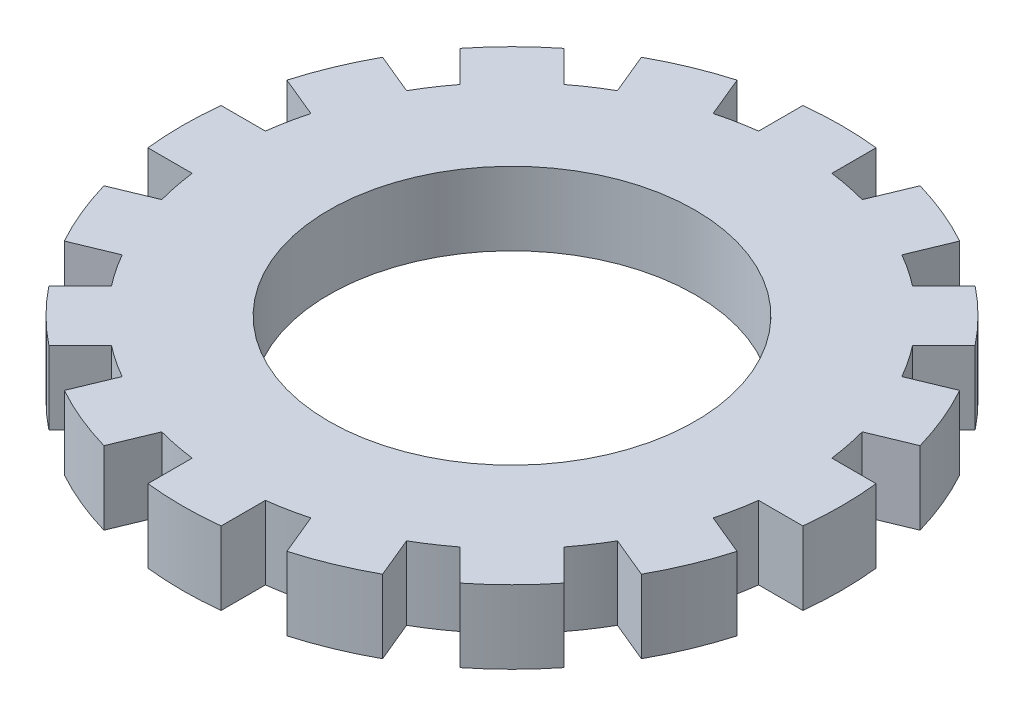
from build123d import *

# Parameters (mm, degrees)
SKETCH1_R           = 25
BOSS_EXTRUDE1_DEPTH = 5


with BuildPart() as part:
    # Sketch1 → Boss-Extrude1 (new, symmetric)
    with BuildSketch(Plane(origin=(0, 0, 0), x_dir=(1, 0, 0), z_dir=(0, 1, 0))):
        with BuildLine():
            Line((10.182093062, 37.647376813), (12.49472571, 43.230565916))
            ThreePointArc((12.49472571, 43.230565916), (17.220754456, 41.574578963), (21.733521035, 39.403731592))
            Line((21.733521035, 39.403731592), (19.420888387, 33.820542489))
            ThreePointArc((19.420888387, 33.820542489), (21.667239088, 32.42731488), (23.814054756, 30.885122568))
            Line((23.814054756, 30.885122568), (28.087242696, 35.158310508))
            ThreePointArc((28.087242696, 35.158310508), (31.819805153, 31.819805153), (35.158310508, 28.087242696))
            Line((35.158310508, 28.087242696), (30.885122568, 23.814054756))
            ThreePointArc((30.885122568, 23.814054756), (32.42731488, 21.667239088), (33.820542489, 19.420888387))
            Line((33.820542489, 19.420888387), (39.403731592, 21.733521035))
            ThreePointArc((39.403731592, 21.733521035), (41.574578963, 17.220754456), (43.230565916, 12.49472571))
            Line((43.230565916, 12.49472571), (37.647376813, 10.182093062))
            ThreePointArc((37.647376813, 10.182093062), (38.250625936, 7.608522559), (38.678159212, 5))
            Line((38.678159212, 5), (44.72135955, 5))
            ThreePointArc((44.72135955, 5), (45, 0), (44.72135955, -5))
            Line((44.72135955, -5), (38.678159212, -5))
            ThreePointArc((38.678159212, -5), (38.250625936, -7.608522559), (37.647376813, -10.182093062))
            Line((37.647376813, -10.182093062), (43.230565916, -12.49472571))
            ThreePointArc((43.230565916, -12.49472571), (41.574578963, -17.220754456), (39.403731592, -21.733521035))
            Line((39.403731592, -21.733521035), (33.820542489, -19.420888387))
            ThreePointArc((33.820542489, -19.420888387), (32.42731488, -21.667239088), (30.885122568, -23.814054756))
            Line((30.885122568, -23.814054756), (35.158310508, -28.087242696))
            ThreePointArc((35.158310508, -28.087242696), (31.819805153, -31.819805153), (28.087242696, -35.158310508))
            Line((28.087242696, -35.158310508), (23.814054756, -30.885122568))
            ThreePointArc((23.814054756, -30.885122568), (21.667239088, -32.42731488), (19.420888387, -33.820542489))
            Line((19.420888387, -33.820542489), (21.733521035, -39.403731592))
            ThreePointArc((21.733521035, -39.403731592), (17.220754456, -41.574578963), (12.49472571, -43.230565916))
            Line((12.49472571, -43.230565916), (10.182093062, -37.647376813))
            ThreePointArc((10.182093062, -37.647376813), (7.608522559, -38.250625936), (5, -38.678159212))
            Line((5, -38.678159212), (5, -44.72135955))
            ThreePointArc((5, -44.72135955), (0, -45), (-5, -44.72135955))
            Line((-5, -44.72135955), (-5, -38.678159212))
            ThreePointArc((-5, -38.678159212), (-7.608522559, -38.250625936), (-10.182093062, -37.647376813))
            Line((-10.182093062, -37.647376813), (-12.49472571, -43.230565916))
            ThreePointArc((-12.49472571, -43.230565916), (-17.220754456, -41.574578963), (-21.733521035, -39.403731592))
            Line((-21.733521035, -39.403731592), (-19.420888387, -33.820542489))
            ThreePointArc((-19.420888387, -33.820542489), (-21.667239088, -32.42731488), (-23.814054756, -30.885122568))
            Line((-23.814054756, -30.885122568), (-28.087242696, -35.158310508))
            ThreePointArc((-28.087242696, -35.158310508), (-31.819805153, -31.819805153), (-35.158310508, -28.087242696))
            Line((-35.158310508, -28.087242696), (-30.885122568, -23.814054756))
            ThreePointArc((-30.885122568, -23.814054756), (-32.42731488, -21.667239088), (-33.820542489, -19.420888387))
            Line((-33.820542489, -19.420888387), (-39.403731592, -21.733521035))
            ThreePointArc((-39.403731592, -21.733521035), (-41.574578963, -17.220754456), (-43.230565916, -12.49472571))
            Line((-43.230565916, -12.49472571), (-37.647376813, -10.182093062))
            ThreePointArc((-37.647376813, -10.182093062), (-38.250625936, -7.608522559), (-38.678159212, -5))
            Line((-38.678159212, -5), (-44.72135955, -5))
            ThreePointArc((-44.72135955, -5), (-45, 0), (-44.72135955, 5))
            Line((-44.72135955, 5), (-38.678159212, 5))
            ThreePointArc((-38.678159212, 5), (-38.250625936, 7.608522559), (-37.647376813, 10.182093062))
            Line((-37.647376813, 10.182093062), (-43.230565916, 12.49472571))
            ThreePointArc((-43.230565916, 12.49472571), (-41.574578963, 17.220754456), (-39.403731592, 21.733521035))
            Line((-39.403731592, 21.733521035), (-33.820542489, 19.420888387))
            ThreePointArc((-33.820542489, 19.420888387), (-32.42731488, 21.667239088), (-30.885122568, 23.814054756))
            Line((-30.885122568, 23.814054756), (-35.158310508, 28.087242696))
            ThreePointArc((-35.158310508, 28.087242696), (-31.819805153, 31.819805153), (-28.087242696, 35.158310508))
            Line((-28.087242696, 35.158310508), (-23.814054756, 30.885122568))
            ThreePointArc((-23.814054756, 30.885122568), (-21.667239088, 32.42731488), (-19.420888387, 33.820542489))
            Line((-19.420888387, 33.820542489), (-21.733521035, 39.403731592))
            ThreePointArc((-21.733521035, 39.403731592), (-17.220754456, 41.574578963), (-12.49472571, 43.230565916))
            Line((-12.49472571, 43.230565916), (-10.182093062, 37.647376813))
            ThreePointArc((-10.182093062, 37.647376813), (-7.608522559, 38.250625936), (-5, 38.678159212))
            Line((-5, 38.678159212), (-5, 44.72135955))
            ThreePointArc((-5, 44.72135955), (0, 45), (5, 44.72135955))
            Line((5, 44.72135955), (5, 38.678159212))
            ThreePointArc((5, 38.678159212), (7.608522559, 38.250625936), (10.182093062, 37.647376813))
        make_face()
        with Locations(Location((0, 0, 0), (0, 0, 270))):
            Circle(SKETCH1_R, mode=Mode.SUBTRACT)
    extrude(amount=BOSS_EXTRUDE1_DEPTH, both=True)


solid = part.part
